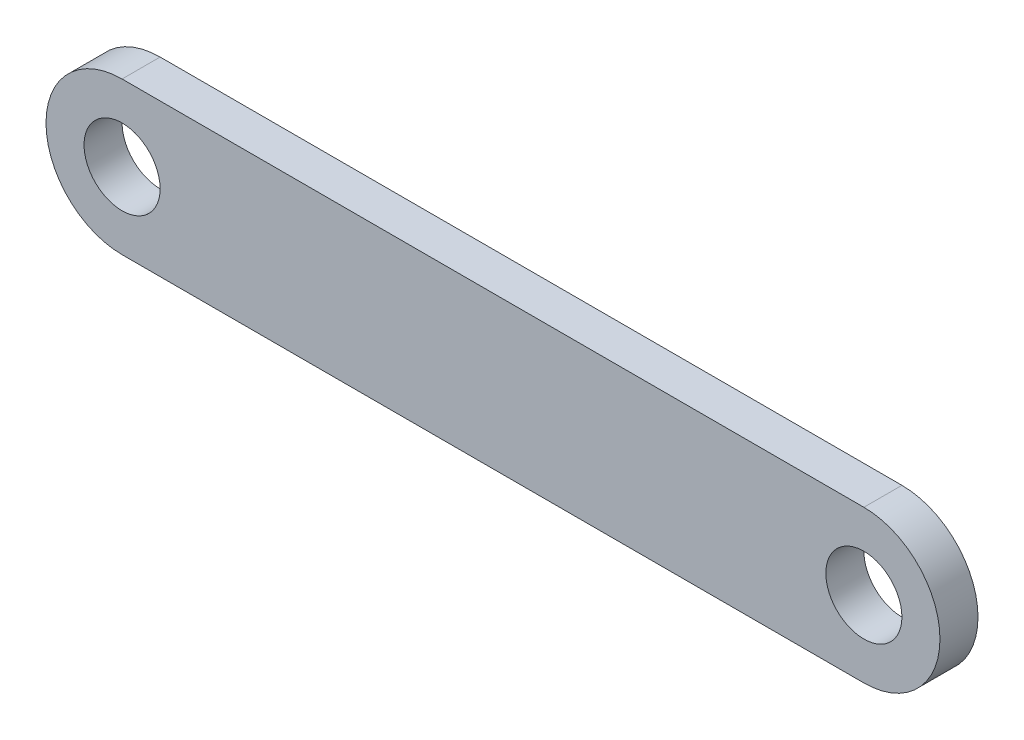
from build123d import *

# Parameters (mm, degrees)
ESBO_O1_R                = 1
RESSALTO_EXTRUS_O1_DEPTH = 1


with BuildPart() as part:
    # Esboço1 → Ressalto-extrusão1 (new body)
    with BuildSketch(Plane.XY):
        with BuildLine():
            Line((-9.75, 2), (9.75, 2))
            ThreePointArc((9.75, 2), (11.75, 0), (9.75, -2))
            Line((9.75, -2), (-9.75, -2))
            ThreePointArc((-9.75, -2), (-11.75, 0), (-9.75, 2))
        make_face()
        with Locations((-9.75, 0)):
            Circle(ESBO_O1_R, mode=Mode.SUBTRACT)
        with Locations((9.75, 0)):
            Circle(ESBO_O1_R, mode=Mode.SUBTRACT)
    extrude(amount=RESSALTO_EXTRUS_O1_DEPTH)


solid = part.part
